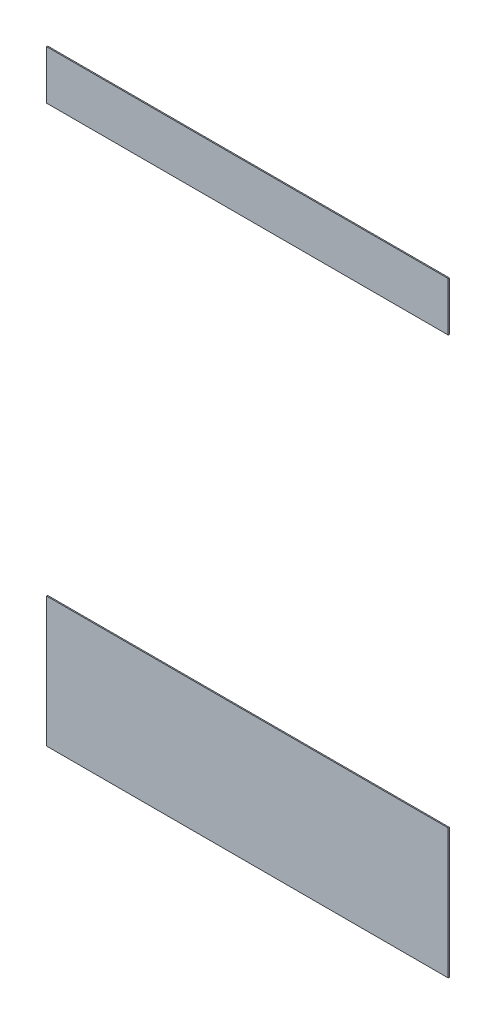
from build123d import *

# Parameters (mm, degrees)
SKETCH_1_W        = 360
SKETCH_1_H        = 116.500000206
EXTRUDE_1_DEPTH   = 1
SKETCH_1_H_2      = 43.894548123
EXTRUDE_1_2_DEPTH = 1


with BuildPart() as part:
    # 草图1 → 凸台-拉伸1 (new body)
    with BuildSketch(Plane.XY):
        with Locations((-180, 68.250000103)):
            Rectangle(SKETCH_1_W, SKETCH_1_H)
    extrude(amount=-EXTRUDE_1_DEPTH)


with BuildPart() as body_2:
    # 草图1 → Extrude 1 2 (new body)
    with BuildSketch(Plane.XY):
        with Locations((-180, 531.052725975)):
            Rectangle(SKETCH_1_W, SKETCH_1_H_2)
    extrude(amount=-EXTRUDE_1_2_DEPTH)


solid = Compound([part.part, body_2.part])
